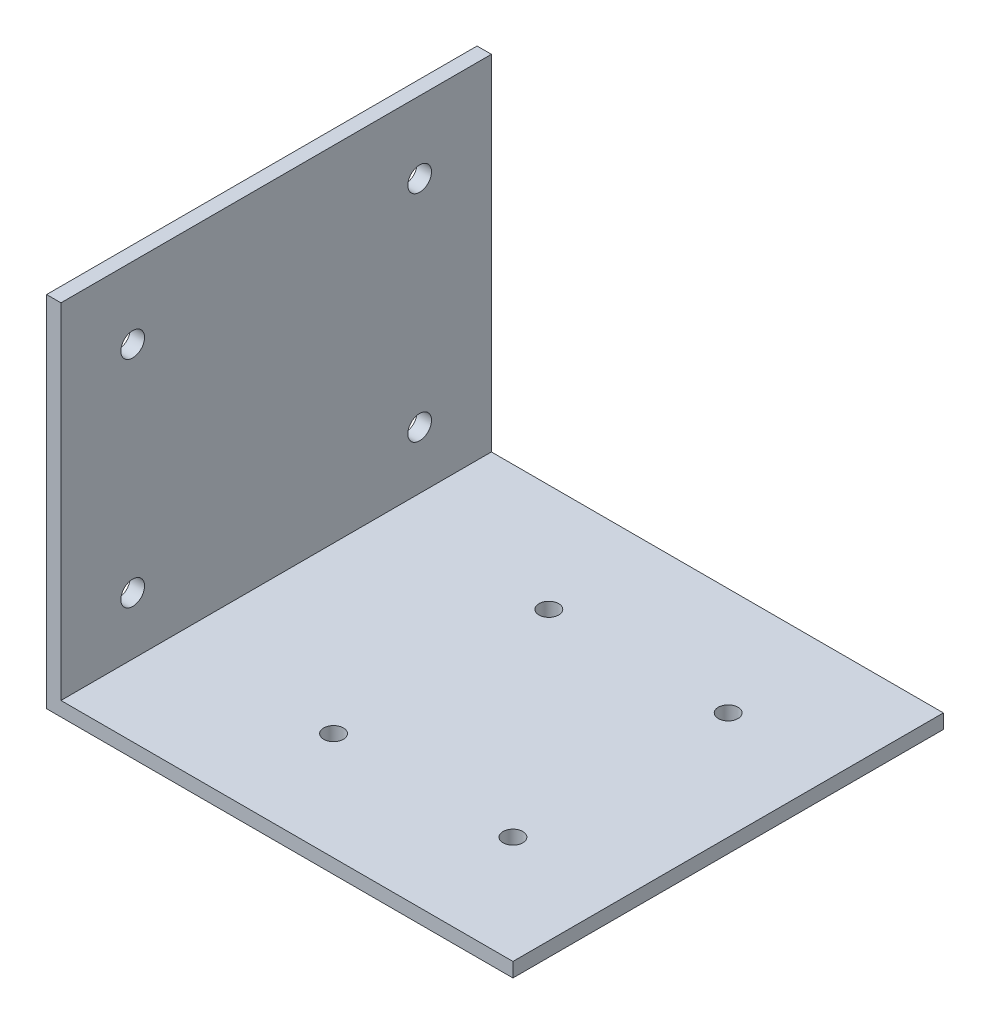
from build123d import *

# Parameters (mm, degrees)
BOSS_EXTRUDE1_DEPTH = 120
SKETCH4_R           = 3.3
CUT_EXTRUDE1_DEPTH  = 201.688813839
SKETCH5_R           = 2.75
CUT_EXTRUDE2_DEPTH  = 202.285866369


with BuildPart() as part:
    # Sketch2 → Boss-Extrude1 (new body)
    with BuildSketch(Plane.XY):
        Polygon((0, 0), (0, 100), (4, 100), (4, 4), (130, 4), (130, 0), align=None)
    extrude(amount=BOSS_EXTRUDE1_DEPTH)

    # Sketch4 → Cut-Extrude1 (cut, through all)
    with BuildSketch(Plane(origin=(4, 0, 0), x_dir=(0, 0, -1), z_dir=(1, 0, 0))):
        with Locations(Location((-100, 80, 0), (0, 0, 90))):
            Circle(SKETCH4_R)
        with Locations(Location((-20, 80, 0), (0, 0, 90))):
            Circle(SKETCH4_R)
        with Locations(Location((-20, 20, 0), (0, 0, 90))):
            Circle(SKETCH4_R)
        with Locations(Location((-100, 20, 0), (0, 0, 90))):
            Circle(SKETCH4_R)
    extrude(amount=-CUT_EXTRUDE1_DEPTH, mode=Mode.SUBTRACT)

    # Sketch5 → Cut-Extrude2 (cut, through all)
    with BuildSketch(Plane(origin=(0, 4, 0), x_dir=(1, 0, 0), z_dir=(0, 1, 0))):
        with Locations(Location((100, -30, 0), (0, 0, 180))):
            Circle(SKETCH5_R)
        with Locations(Location((50, -30, 0), (0, 0, 180))):
            Circle(SKETCH5_R)
        with Locations(Location((50, -90, 0), (0, 0, 180))):
            Circle(SKETCH5_R)
        with Locations(Location((100, -90, 0), (0, 0, 180))):
            Circle(SKETCH5_R)
    extrude(amount=-CUT_EXTRUDE2_DEPTH, mode=Mode.SUBTRACT)


solid = part.part
